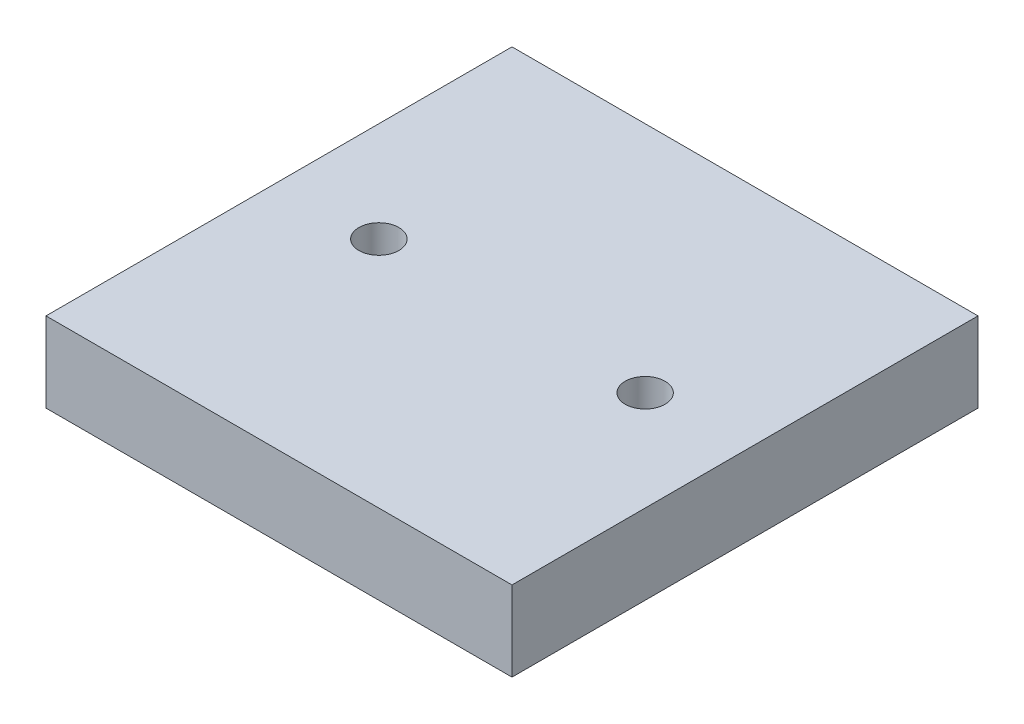
from build123d import *

# Parameters (mm, degrees)
SKETCH1_W           = 70
SKETCH1_H           = 70
SKETCH1_R           = 3
BOSS_EXTRUDE1_DEPTH = 12


with BuildPart() as part:
    # Sketch1 → Boss-Extrude1 (new body)
    with BuildSketch(Plane(origin=(0, 0, 0), x_dir=(1, 0, 0), z_dir=(0, 1, 0))):
        Rectangle(SKETCH1_W, SKETCH1_H)
        with Locations(Location((-20, 0, 0), (0, 0, 270))):
            Circle(SKETCH1_R, mode=Mode.SUBTRACT)
        with Locations(Location((20, 0, 0), (0, 0, 270))):
            Circle(SKETCH1_R, mode=Mode.SUBTRACT)
    extrude(amount=BOSS_EXTRUDE1_DEPTH)


solid = part.part
